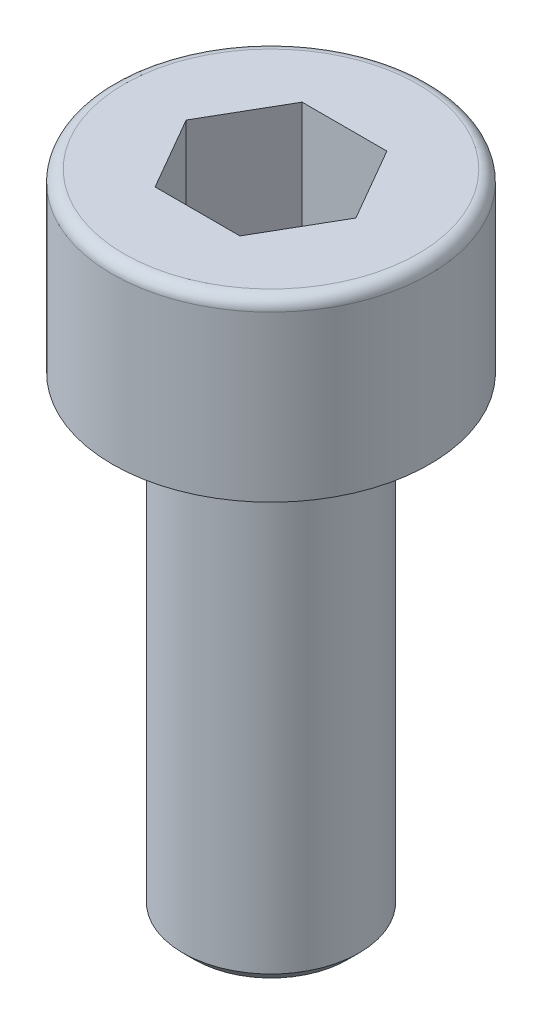
from build123d import *

# Parameters (mm, degrees)
CUT_EXTRUDE1_DEPTH = 2


with BuildPart() as part:
    # Sketch1 → Revolve1 (revolve)
    with BuildSketch(Plane(origin=(0, 0, 0), x_dir=(0, 0, -1), z_dir=(1, 0, 0)), mode=Mode.PRIVATE) as revolve1_sk:
        with BuildLine():
            Line((0, 3), (0, -8))
            Line((0, -8), (1.3, -8))
            Line((1.3, -8), (1.5, -7.8))
            Line((1.5, -7.8), (1.5, -0.2))
            ThreePointArc((1.5, -0.2), (1.558578644, -0.058578644), (1.7, 0))
            Line((1.7, 0), (2.7, 0))
            Line((2.7, 0), (2.7, 2.8))
            ThreePointArc((2.7, 2.8), (2.641421356, 2.941421356), (2.5, 3))
            Line((2.5, 3), (0, 3))
        make_face()
    revolve(revolve1_sk.sketch.rotate(Axis((0, 11.82745098, 0), (0, -1, 0)), 180), axis=Axis((0, 11.82745098, 0), (0, -1, 0)))

    # Sketch2 → Cut-Extrude1 (cut)
    with BuildSketch(Plane(origin=(0, 3, 0), x_dir=(1, 0, 0), z_dir=(0, 1, 0))):
        Polygon((0.721687836, 1.25), (-0.721687836, 1.25), (-1.443375673, 0), (-0.721687836, -1.25), (0.721687836, -1.25), (1.443375673, 0), align=None)
    extrude(amount=-CUT_EXTRUDE1_DEPTH, mode=Mode.SUBTRACT)


solid = part.part
